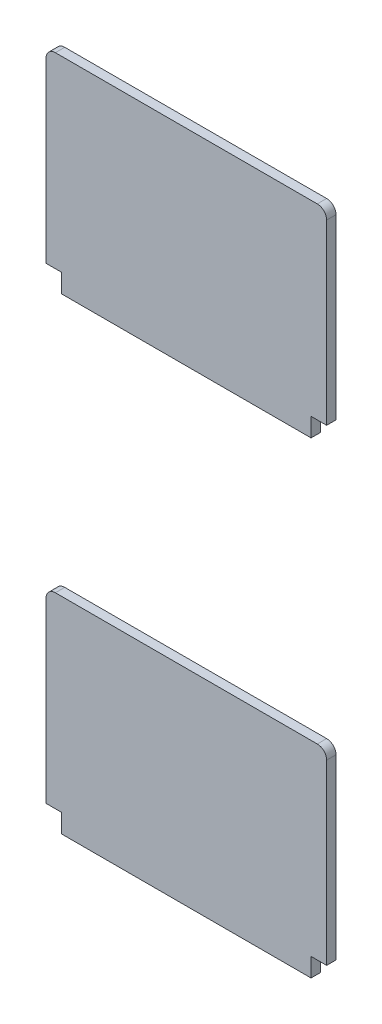
from build123d import *

# Parameters (mm, degrees)
SKETCH_1_W      = 80
SKETCH_1_H      = 6
EXTRUDE_1_DEPTH = 3


with BuildPart() as part:
    # 草圖1 → 填料-伸長1 (new body)
    with BuildSketch(Plane.XY):
        with Locations((40, -3)):
            Rectangle(SKETCH_1_W, SKETCH_1_H)
        with BuildLine():
            Line((-5, 0), (85, 0))
            Line((85, 0), (85, 57))
            ThreePointArc((85, 57), (84.121320344, 59.121320344), (82, 60))
            Line((82, 60), (-2, 60))
            ThreePointArc((-2, 60), (-4.121320344, 59.121320344), (-5, 57))
            Line((-5, 57), (-5, 0))
        make_face()
        with Locations((40, 147)):
            Rectangle(SKETCH_1_W, SKETCH_1_H)
        with BuildLine():
            Line((-5, 150), (-5, 207))
            ThreePointArc((-5, 207), (-4.121320344, 209.121320344), (-2, 210))
            Line((-2, 210), (82, 210))
            ThreePointArc((82, 210), (84.121320344, 209.121320344), (85, 207))
            Line((85, 207), (85, 150))
            Line((85, 150), (-5, 150))
        make_face()
    extrude(amount=EXTRUDE_1_DEPTH)


solid = part.part
